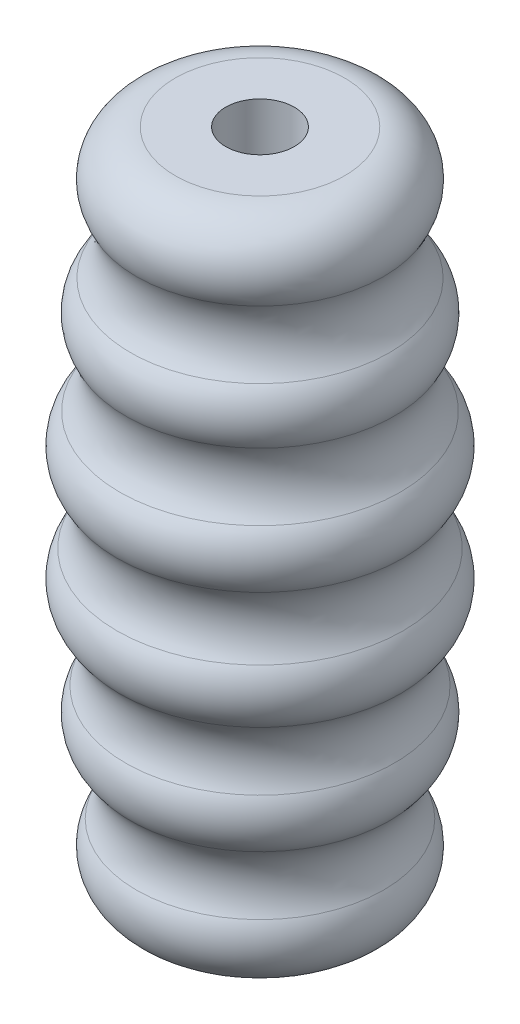
from build123d import *


with BuildPart() as part:
    # Çizim1 → Döndür1 (revolve)
    with BuildSketch(Plane.XY):
        with BuildLine():
            Line((-4.7, 18.5), (-1.9, 18.5))
            Line((-1.9, 18.5), (-1.9, -18.5))
            Line((-1.9, -18.5), (-4.7, -18.5))
            ThreePointArc((-4.7, -18.5), (-6.869442136, -17.242385132), (-6.856226125, -14.734816654))
            ThreePointArc((-6.856226125, -14.734816654), (-6.456794796, -12.936574512), (-7.183498852, -11.243907563))
            ThreePointArc((-7.183498852, -11.243907563), (-7.789085565, -9.833351772), (-7.456226125, -8.334816654))
            ThreePointArc((-7.456226125, -8.334816654), (-7.056794796, -6.536574512), (-7.783498852, -4.843907563))
            ThreePointArc((-7.783498852, -4.843907563), (-8.397083421, -3.320724433), (-7.933297204, -1.745454545))
            ThreePointArc((-7.933297204, -1.745454545), (-7.373253849, 0), (-7.933297204, 1.745454545))
            ThreePointArc((-7.933297204, 1.745454545), (-8.397083421, 3.320724433), (-7.783498852, 4.843907563))
            ThreePointArc((-7.783498852, 4.843907563), (-7.056794796, 6.536574512), (-7.456226125, 8.334816654))
            ThreePointArc((-7.456226125, 8.334816654), (-7.789085565, 9.833351772), (-7.183498852, 11.243907563))
            ThreePointArc((-7.183498852, 11.243907563), (-6.456794796, 12.936574512), (-6.856226125, 14.734816654))
            ThreePointArc((-6.856226125, 14.734816654), (-6.869442136, 17.242385132), (-4.7, 18.5))
        make_face()
    revolve(axis=Axis((0, 25.885681486, 0), (0, -1, 0)))


solid = part.part
